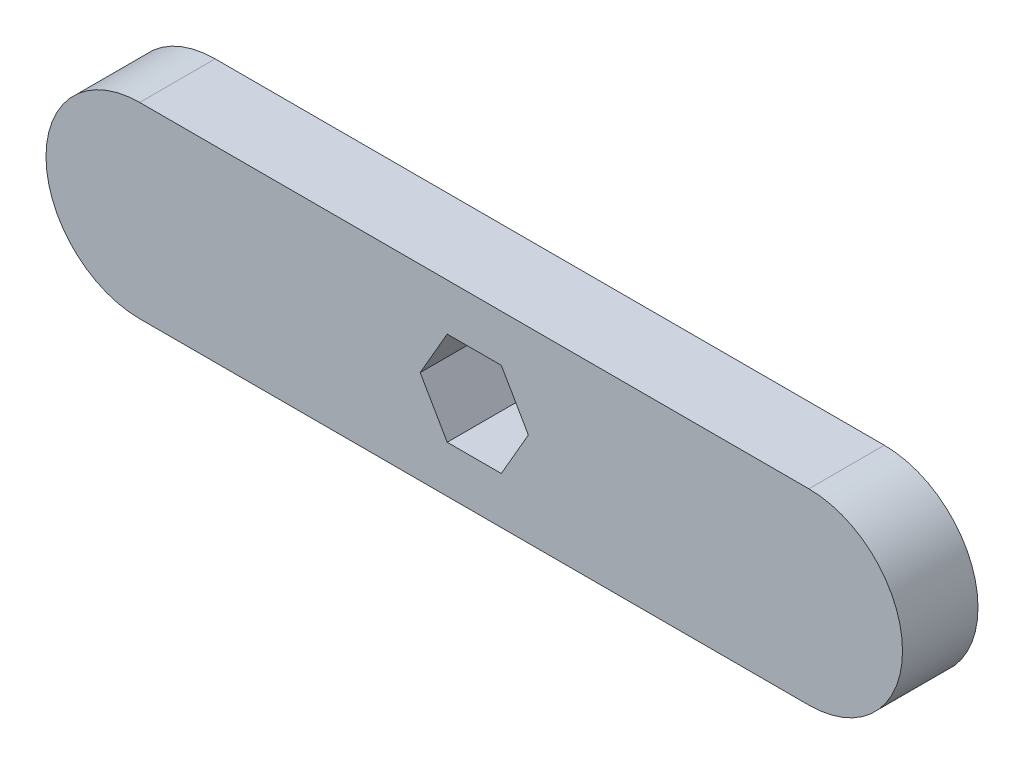
from build123d import *

# Parameters (mm, degrees)
BOSS_EXTRUDE2_DEPTH = 5.64


with BuildPart() as part:
    # Sketch1 → Boss-Extrude2 (new body)
    with BuildSketch(Plane.XY):
        with BuildLine():
            Line((-25, 7), (25, 7))
            ThreePointArc((25, 7), (32, 0), (25, -7))
            Line((25, -7), (-25, -7))
            ThreePointArc((-25, -7), (-32, 0), (-25, 7))
        make_face()
        Polygon((-2.020725942, 3.5), (-4.041451884, 0), (-2.020725942, -3.5), (2.020725942, -3.5), (4.041451884, 0), (2.020725942, 3.5), align=None, mode=Mode.SUBTRACT)
    extrude(amount=BOSS_EXTRUDE2_DEPTH)


solid = part.part
